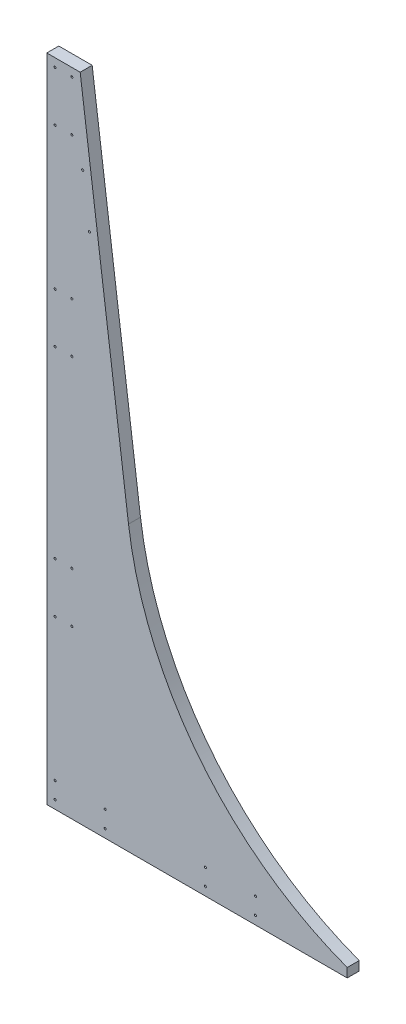
from build123d import *

# Parameters (mm, degrees)
BOSS_EXTRUDE1_DEPTH = 18.25625
SKETCH2_R           = 1.5875
CUT_EXTRUDE1_DEPTH  = 1092.171116308
SKETCH3_R           = 1.5875
CUT_EXTRUDE2_DEPTH  = 1092.171116308


with BuildPart() as part:
    # Sketch1 → Boss-Extrude1 (new body)
    with BuildSketch(Plane.XY):
        with BuildLine():
            Line((0, 990.6), (0, 0))
            Line((0, 0), (457.201, 0))
            Line((457.201, 0), (457.201, 13.862038208))
            ThreePointArc((457.201, 13.862038208), (232.767577124, 176.628269142), (124.367415652, 431.8))
            Line((124.367415652, 431.8), (50.8, 990.6))
            Line((50.8, 990.6), (0, 990.6))
        make_face()
    extrude(amount=BOSS_EXTRUDE1_DEPTH)

    # Sketch2 → Cut-Extrude1 (cut, through all)
    with BuildSketch(Plane.XY.offset(18.25625)):
        with Locations((12.7, 977.9)):
            Circle(SKETCH2_R)
        with Locations((38.1, 977.9)):
            Circle(SKETCH2_R)
        with Locations((12.7, 901.7)):
            Circle(SKETCH2_R)
        with Locations((38.1, 901.7)):
            Circle(SKETCH2_R)
        with Locations((12.7, 609.6)):
            Circle(SKETCH2_R)
        with Locations((38.1, 609.6)):
            Circle(SKETCH2_R)
        with Locations((12.7, 685.8)):
            Circle(SKETCH2_R)
        with Locations((38.1, 685.8)):
            Circle(SKETCH2_R)
        with Locations((12.7, 254)):
            Circle(SKETCH2_R)
        with Locations((38.1, 254)):
            Circle(SKETCH2_R)
        with Locations((12.7, 330.2)):
            Circle(SKETCH2_R)
        with Locations((38.1, 330.2)):
            Circle(SKETCH2_R)
        with Locations((12.7, 38.1)):
            Circle(SKETCH2_R)
        with Locations((12.7, 12.7)):
            Circle(SKETCH2_R)
        with Locations((88.9, 38.1)):
            Circle(SKETCH2_R)
        with Locations((88.9, 12.7)):
            Circle(SKETCH2_R)
        with Locations((241.3, 38.1)):
            Circle(SKETCH2_R)
        with Locations((317.5, 38.1)):
            Circle(SKETCH2_R)
        with Locations((241.3, 12.7)):
            Circle(SKETCH2_R)
        with Locations((317.5, 12.7)):
            Circle(SKETCH2_R)
    extrude(amount=-CUT_EXTRUDE1_DEPTH, mode=Mode.SUBTRACT)

    # Sketch3 → Cut-Extrude2 (cut, through all)
    with BuildSketch(Plane.XY.offset(18.25625)):
        with Locations((64.74219971, 787.4)):
            Circle(SKETCH3_R)
        with Locations((54.710279394, 863.6)):
            Circle(SKETCH3_R)
    extrude(amount=-CUT_EXTRUDE2_DEPTH, mode=Mode.SUBTRACT)


solid = part.part
